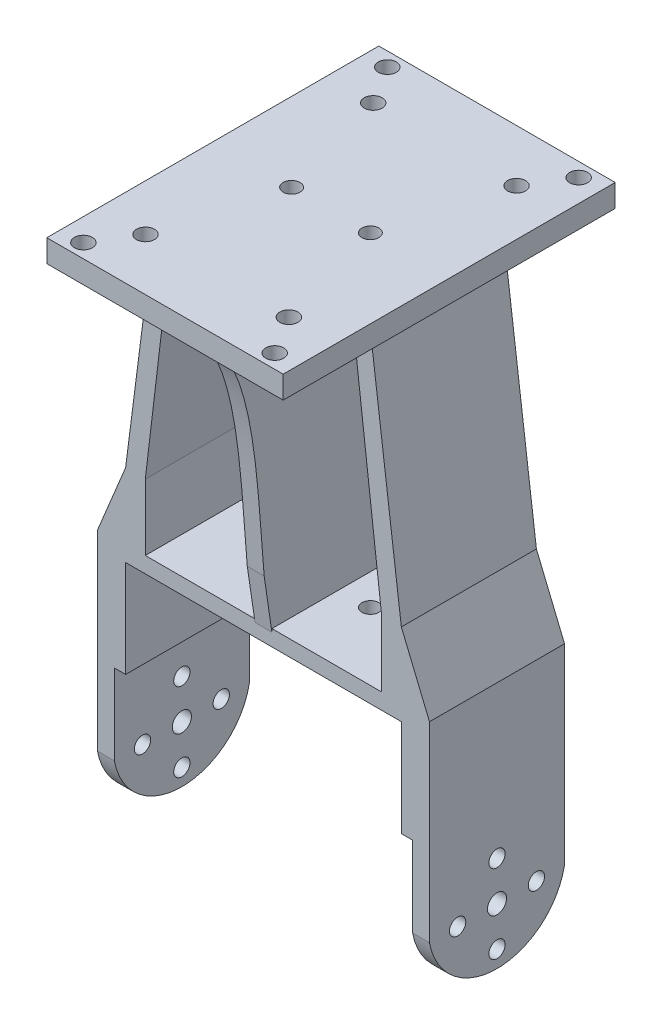
from build123d import *

# Parameters (mm, degrees)
SKETCH_1_W               = 59
SKETCH_1_H               = 100
EXTRUDE_1_DEPTH          = 24
SKETCH_3_R               = 1.45
SKETCH_3_R_2             = 1.7
CUT_EXTRUDE_1_DEPTH      = 85.1546196
CUT_EXTRUDE_2_DEPTH      = 67.867406111
SKETCH_5_W               = 42
SKETCH_5_H               = 59
SKETCH_5_R               = 1.6
EXTRUDE_2_DEPTH          = 2
EXTRUDE_3_DEPTH          = 1.5
CUT_EXTRUDE_3_DEPTH      = 91.709701842
CUT_EXTRUDE_3_DEPTH_BACK = 91.709701842
SKETCH_9_R               = 1.5
CUT_EXTRUDE_4_DEPTH      = 115.002192998


with BuildPart() as part:
    # 草图1 → 凸台-拉伸1 (new body)
    with BuildSketch(Plane.XY):
        with Locations((0, -5)):
            Rectangle(SKETCH_1_W, SKETCH_1_H)
    extrude(amount=EXTRUDE_1_DEPTH)

    # 草图3 → 切除-拉伸1 (cut, through all)
    with BuildSketch(Plane.ZY.offset(29.5)):
        with Locations(Location((12, -38, 0), (0, 0, 270))):
            Circle(SKETCH_3_R)
        with Locations(Location((12, -45, 0), (0, 0, 270))):
            Circle(SKETCH_3_R_2)
        with Locations(Location((19, -45, 0), (0, 0, 270))):
            Circle(SKETCH_3_R)
        with Locations(Location((12, -52, 0), (0, 0, 270))):
            Circle(SKETCH_3_R)
        with Locations(Location((5, -45, 0), (0, 0, 270))):
            Circle(SKETCH_3_R)
    extrude(amount=-CUT_EXTRUDE_1_DEPTH, mode=Mode.SUBTRACT)

    # 草图4 → 切除-拉伸2 (cut, through all)
    with BuildSketch(Plane.XY.offset(24)):
        Polygon((-24.5, -13.483129661), (-24.5, -30.715572957), (-26.5, -30.715572957), (-26.5, -55), (26.5, -55), (26.5, -30.715572957), (24.5, -30.715572957), (24.5, -13.483129661), align=None)
        Polygon((-29.5, 45), (-29.5, -10.991548546), (-24.5, 1.098015798), (-18.873933883, 45), align=None)
        Polygon((24.5, 1.098015798), (29.5, -10.991548546), (29.5, 45), (18.873933883, 45), align=None)
        Polygon((-1.5, 43.003983046), (-16, 43.003983046), (-21, 1.098015798), (-21, -10.656485647), (-1.5, -10.656485647), align=None)
        Polygon((21, 1.098015798), (16, 43.003983046), (1.5, 43.003983046), (1.5, -10.656485647), (21, -10.656485647), align=None)
    extrude(amount=-CUT_EXTRUDE_2_DEPTH, mode=Mode.SUBTRACT)

    # 草图5 → 凸台-拉伸2 (add, symmetric)
    with BuildSketch(Plane(origin=(0, 45, 0), x_dir=(1, 0, 0), z_dir=(0, 1, 0))):
        with Locations((0, -12)):
            Rectangle(SKETCH_5_W, SKETCH_5_H)
        with Locations(Location((-17, 15, 0), (0, 0, 270))):
            Circle(SKETCH_5_R, mode=Mode.SUBTRACT)
        with Locations(Location((-12.737493843, 8.230137279, 0), (0, 0, 270))):
            Circle(SKETCH_5_R, mode=Mode.SUBTRACT)
        with Locations(Location((12.737493843, 8.230137279, 0), (0, 0, 270))):
            Circle(SKETCH_5_R, mode=Mode.SUBTRACT)
        with Locations(Location((17, 15, 0), (0, 0, 270))):
            Circle(SKETCH_5_R, mode=Mode.SUBTRACT)
        with Locations(Location((17, -39, 0), (0, 0, 270))):
            Circle(SKETCH_5_R, mode=Mode.SUBTRACT)
        with Locations(Location((12.737493843, -32.230137279, 0), (0, 0, 270))):
            Circle(SKETCH_5_R, mode=Mode.SUBTRACT)
        with Locations(Location((-17, -39, 0), (0, 0, 270))):
            Circle(SKETCH_5_R, mode=Mode.SUBTRACT)
        with Locations(Location((-12.737493843, -32.230137279, 0), (0, 0, 270))):
            Circle(SKETCH_5_R, mode=Mode.SUBTRACT)
    extrude(amount=EXTRUDE_2_DEPTH, both=True)

    # 草图7 → 凸台-拉伸3 (add, symmetric)
    with BuildSketch(Plane(origin=(0, 0, 0), x_dir=(0, 0, 1), z_dir=(1, 0, 0))):
        with BuildLine():
            Line((0, -43), (0, 11.218667819))
            Line((0, 11.218667819), (-1.377914125, 1.87990225))
            add(Edge.make_bspline(
                [(-17.5, -43), (-6.662948015, -38.990116627), (-2.969302536, -28.650335037), (-2.475614958, -10.791960979), (-1.377914125, 1.87990225)],
                knots=[0, 0, 0, 0, 0, 1, 1, 1, 1, 1], degree=4))
            Line((-17.5, -43), (0, -43))
        make_face()
        with BuildLine():
            Line((24, -43), (41.5, -43))
            add(Edge.make_bspline(
                [(41.5, -43), (30.662948015, -38.990116627), (26.969302536, -28.650335037), (26.475614958, -10.791960979), (25.377914125, 1.87990225)],
                knots=[0, 0, 0, 0, 0, 1, 1, 1, 1, 1], degree=4))
            Line((25.377914125, 1.87990225), (24, 11.218667819))
            Line((24, 11.218667819), (24, -43))
        make_face()
    extrude(amount=EXTRUDE_3_DEPTH, both=True)

    # 草图8 → 切除-拉伸3 (cut, two sides: drawn at the far end of the back side and taken through both)
    with BuildSketch(Plane(origin=(29.5, 0, 0), x_dir=(0, 0, -1), z_dir=(1, 0, 0)).offset(-CUT_EXTRUDE_3_DEPTH_BACK)):
        with BuildLine():
            Line((-24, -55), (-12, -55))
            ThreePointArc((-12, -55), (-19.810249676, -52.172299611), (-24, -45))
            Line((-24, -45), (-24, -55))
        make_face()
        with BuildLine():
            Line((0, -55), (0, -45))
            ThreePointArc((0, -45), (-4.189750324, -52.172299611), (-12, -55))
            Line((-12, -55), (0, -55))
        make_face()
    extrude(amount=CUT_EXTRUDE_3_DEPTH + CUT_EXTRUDE_3_DEPTH_BACK, mode=Mode.SUBTRACT)

    # 草图9 → 切除-拉伸4 (cut, through all)
    with BuildSketch(Plane(origin=(0, 47, 0), x_dir=(1, 0, 0), z_dir=(0, 1, 0))):
        with Locations(Location((-7, -12, 0), (0, 0, 270))):
            Circle(SKETCH_9_R)
        with Locations(Location((7, -12, 0), (0, 0, 270))):
            Circle(SKETCH_9_R)
    extrude(amount=-CUT_EXTRUDE_4_DEPTH, mode=Mode.SUBTRACT)


solid = part.part
